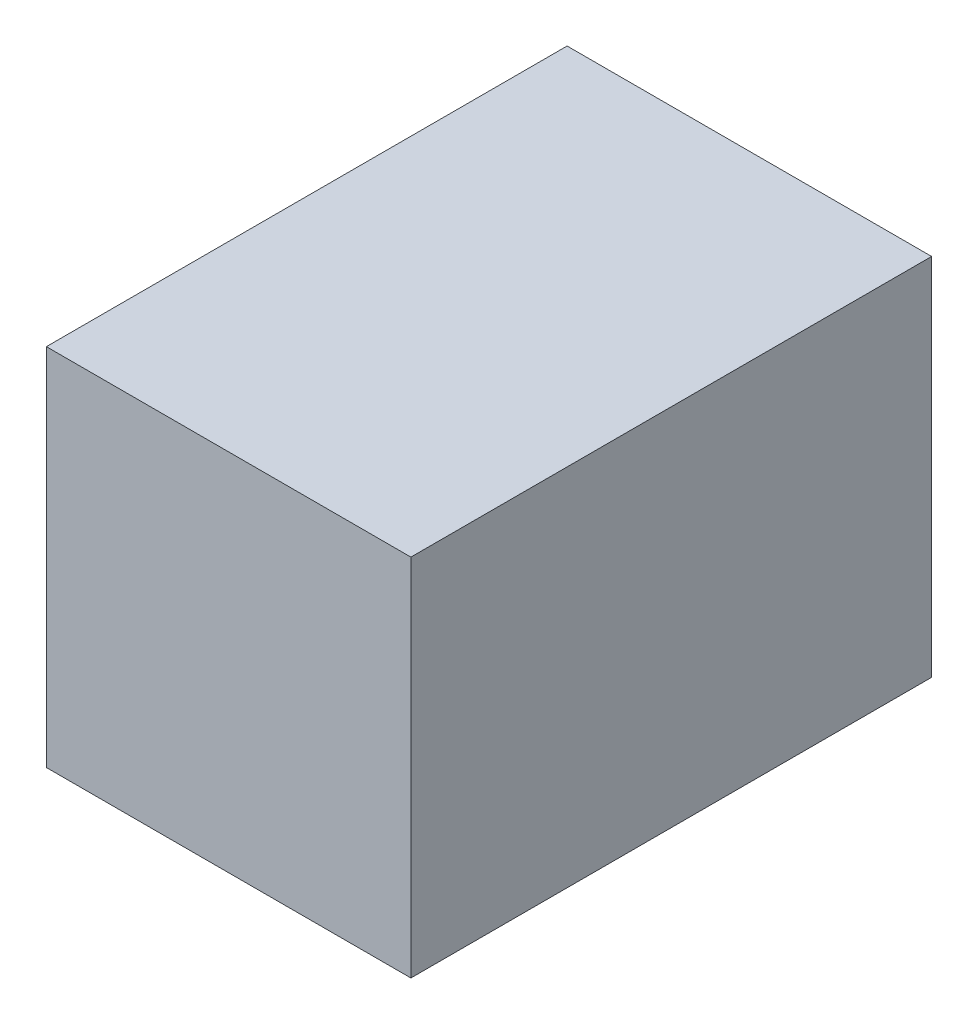
from build123d import *

# Parameters (mm, degrees)
ESQUISSE1_W        = 35
ESQUISSE1_H        = 35
BOSS_EXTRU_1_DEPTH = 50


with BuildPart() as part:
    # Esquisse1 → Boss.-Extru.1 (new body)
    with BuildSketch(Plane.XY):
        Rectangle(ESQUISSE1_W, ESQUISSE1_H)
    extrude(amount=BOSS_EXTRU_1_DEPTH)


solid = part.part
